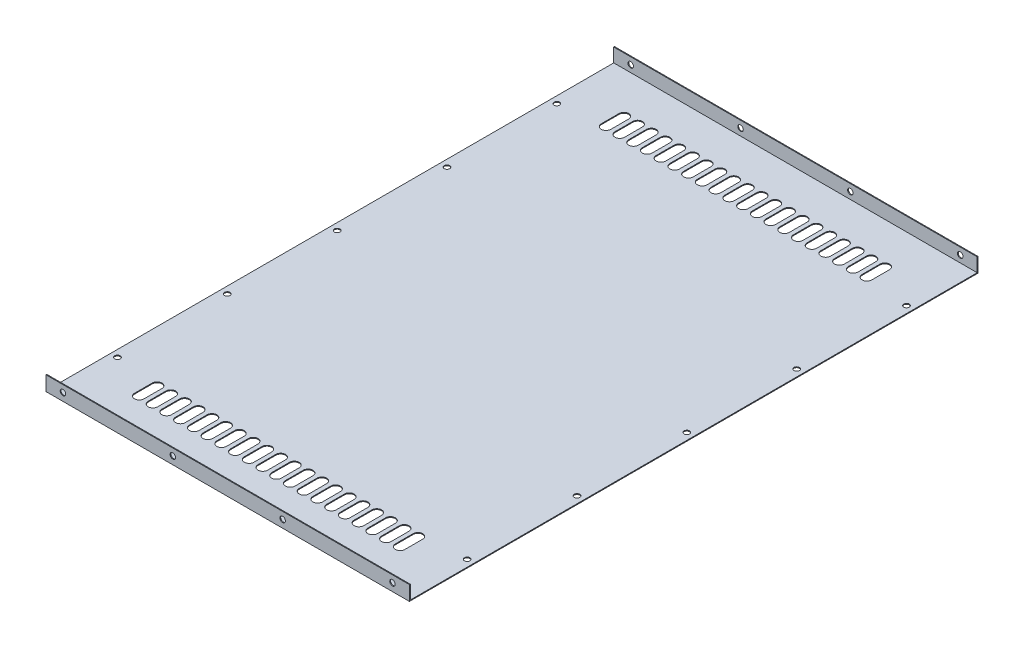
from build123d import *

# Parameters (mm, degrees)
SKETCH_1_W          = 264.7
SKETCH_1_H          = 414.1
EXTRUDE_1_DEPTH     = 0.6
SKETCH_2_W          = 0.6
SKETCH_2_H          = 10.6
EXTRUDE_2_DEPTH     = 264.7
SKETCH_6_R          = 2
CUT_EXTRUDE_1_DEPTH = 246.939474261
CUT_EXTRUDE_2_REACH = 436.865
SKETCH_7_R          = 2
CUT_EXTRUDE_4_DEPTH = 246.939474261


with BuildPart() as part:
    # Эскиз1 → Бобышка-Вытянуть1 (new body)
    with BuildSketch(Plane(origin=(0, 0, 0), x_dir=(1, 0, 0), z_dir=(0, 1, 0))):
        Rectangle(SKETCH_1_W, SKETCH_1_H)
    extrude(amount=EXTRUDE_1_DEPTH)

    # Эскиз2 → Бобышка-Вытянуть2 (add)
    with BuildSketch(Plane(origin=(132.35, 0, 0), x_dir=(0, 0, -1), z_dir=(1, 0, 0))):
        with Locations((-206.75, 5.3)):
            Rectangle(SKETCH_2_W, SKETCH_2_H)
        with Locations((206.75, 5.3)):
            Rectangle(SKETCH_2_W, SKETCH_2_H)
    extrude(amount=-EXTRUDE_2_DEPTH)

    # Эскиз6 → Вырез-Вытянуть1 (cut, through all)
    with BuildSketch(Plane(origin=(0, 0.6, 0), x_dir=(1, 0, 0), z_dir=(0, 1, 0))):
        with Locations(Location((-127.35, -160, 0), (0, 0, 270))):
            Circle(SKETCH_6_R)
        with Locations(Location((-127.35, -80, 0), (0, 0, 270))):
            Circle(SKETCH_6_R)
        with Locations(Location((-127.35, 0, 0), (0, 0, 270))):
            Circle(SKETCH_6_R)
        with Locations(Location((-127.35, 80, 0), (0, 0, 270))):
            Circle(SKETCH_6_R)
        with Locations(Location((-127.35, 160, 0), (0, 0, 270))):
            Circle(SKETCH_6_R)
        with Locations(Location((127.35, -160, 0), (0, 0, 270))):
            Circle(SKETCH_6_R)
        with Locations(Location((127.35, -80, 0), (0, 0, 270))):
            Circle(SKETCH_6_R)
        with Locations(Location((127.35, 0, 0), (0, 0, 270))):
            Circle(SKETCH_6_R)
        with Locations(Location((127.35, 80, 0), (0, 0, 270))):
            Circle(SKETCH_6_R)
        with Locations(Location((127.35, 160, 0), (0, 0, 270))):
            Circle(SKETCH_6_R)
    extrude(amount=-CUT_EXTRUDE_1_DEPTH, mode=Mode.SUBTRACT)

    # Вырез-Вытянуть2: up to this face of the body (flat: up to its plane)
    cut_extrude_2_end = Plane(part.part.faces().sort_by_distance((0, 5.3, 207.05))[0])
    # Эскиз7 → Вырез-Вытянуть2 (cut, up to the picked face)
    with BuildSketch(Plane(origin=(0, 0, -207.05), x_dir=(-1, 0, 0), z_dir=(0, 0, -1)), mode=Mode.PRIVATE) as cut_extrude_2_sk1:
        with Locations((-120, 5.6)):
            Circle(SKETCH_7_R)
    cut_extrude_2_tool1 = split(extrude(cut_extrude_2_sk1.sketch, amount=-CUT_EXTRUDE_2_REACH, mode=Mode.PRIVATE), bisect_by=cut_extrude_2_end, keep=Keep.BOTH, mode=Mode.PRIVATE)
    # Эскиз7 → Вырез-Вытянуть2 (cut, up to the picked face)
    with BuildSketch(Plane(origin=(0, 0, -207.05), x_dir=(-1, 0, 0), z_dir=(0, 0, -1)), mode=Mode.PRIVATE) as cut_extrude_2_sk2:
        with Locations((-40, 5.6)):
            Circle(SKETCH_7_R)
    cut_extrude_2_tool2 = split(extrude(cut_extrude_2_sk2.sketch, amount=-CUT_EXTRUDE_2_REACH, mode=Mode.PRIVATE), bisect_by=cut_extrude_2_end, keep=Keep.BOTH, mode=Mode.PRIVATE)
    # Эскиз7 → Вырез-Вытянуть2 (cut, up to the picked face)
    with BuildSketch(Plane(origin=(0, 0, -207.05), x_dir=(-1, 0, 0), z_dir=(0, 0, -1)), mode=Mode.PRIVATE) as cut_extrude_2_sk3:
        with Locations((40, 5.6)):
            Circle(SKETCH_7_R)
    cut_extrude_2_tool3 = split(extrude(cut_extrude_2_sk3.sketch, amount=-CUT_EXTRUDE_2_REACH, mode=Mode.PRIVATE), bisect_by=cut_extrude_2_end, keep=Keep.BOTH, mode=Mode.PRIVATE)
    # Эскиз7 → Вырез-Вытянуть2 (cut, up to the picked face)
    with BuildSketch(Plane(origin=(0, 0, -207.05), x_dir=(-1, 0, 0), z_dir=(0, 0, -1)), mode=Mode.PRIVATE) as cut_extrude_2_sk4:
        with Locations((120, 5.6)):
            Circle(SKETCH_7_R)
    cut_extrude_2_tool4 = split(extrude(cut_extrude_2_sk4.sketch, amount=-CUT_EXTRUDE_2_REACH, mode=Mode.PRIVATE), bisect_by=cut_extrude_2_end, keep=Keep.BOTH, mode=Mode.PRIVATE)
    add(cut_extrude_2_tool1.solids().sort_by(Axis((120, 5.6, -207.05), (0, 0, 1)))[0], mode=Mode.SUBTRACT)
    add(cut_extrude_2_tool2.solids().sort_by(Axis((40, 5.6, -207.05), (0, 0, 1)))[0], mode=Mode.SUBTRACT)
    add(cut_extrude_2_tool3.solids().sort_by(Axis((-40, 5.6, -207.05), (0, 0, 1)))[0], mode=Mode.SUBTRACT)
    add(cut_extrude_2_tool4.solids().sort_by(Axis((-120, 5.6, -207.05), (0, 0, 1)))[0], mode=Mode.SUBTRACT)

    # Эскиз8 → Вырез-Вытянуть4 (cut, through all)
    with BuildSketch(Plane(origin=(0, 0.6, 0), x_dir=(1, 0, 0), z_dir=(0, 1, 0))):
        with BuildLine():
            Line((-91.5, 176.5), (-91.5, 163.5))
            ThreePointArc((-91.5, 163.5), (-95, 160), (-98.5, 163.5))
            Line((-98.5, 163.5), (-98.5, 176.5))
            ThreePointArc((-98.5, 176.5), (-95, 180), (-91.5, 176.5))
        make_face()
        with BuildLine():
            Line((-81.5, 176.5), (-81.5, 163.5))
            ThreePointArc((-81.5, 163.5), (-85, 160), (-88.5, 163.5))
            Line((-88.5, 163.5), (-88.5, 176.5))
            ThreePointArc((-88.5, 176.5), (-85, 180), (-81.5, 176.5))
        make_face()
        with BuildLine():
            Line((-71.5, 176.5), (-71.5, 163.5))
            ThreePointArc((-71.5, 163.5), (-75, 160), (-78.5, 163.5))
            Line((-78.5, 163.5), (-78.5, 176.5))
            ThreePointArc((-78.5, 176.5), (-75, 180), (-71.5, 176.5))
        make_face()
        with BuildLine():
            Line((-61.5, 176.5), (-61.5, 163.5))
            ThreePointArc((-61.5, 163.5), (-65, 160), (-68.5, 163.5))
            Line((-68.5, 163.5), (-68.5, 176.5))
            ThreePointArc((-68.5, 176.5), (-65, 180), (-61.5, 176.5))
        make_face()
        with BuildLine():
            Line((-51.5, 176.5), (-51.5, 163.5))
            ThreePointArc((-51.5, 163.5), (-55, 160), (-58.5, 163.5))
            Line((-58.5, 163.5), (-58.5, 176.5))
            ThreePointArc((-58.5, 176.5), (-55, 180), (-51.5, 176.5))
        make_face()
        with BuildLine():
            Line((-41.5, 176.5), (-41.5, 163.5))
            ThreePointArc((-41.5, 163.5), (-45, 160), (-48.5, 163.5))
            Line((-48.5, 163.5), (-48.5, 176.5))
            ThreePointArc((-48.5, 176.5), (-45, 180), (-41.5, 176.5))
        make_face()
        with BuildLine():
            Line((-31.5, 176.5), (-31.5, 163.5))
            ThreePointArc((-31.5, 163.5), (-35, 160), (-38.5, 163.5))
            Line((-38.5, 163.5), (-38.5, 176.5))
            ThreePointArc((-38.5, 176.5), (-35, 180), (-31.5, 176.5))
        make_face()
        with BuildLine():
            Line((-21.5, 176.5), (-21.5, 163.5))
            ThreePointArc((-21.5, 163.5), (-25, 160), (-28.5, 163.5))
            Line((-28.5, 163.5), (-28.5, 176.5))
            ThreePointArc((-28.5, 176.5), (-25, 180), (-21.5, 176.5))
        make_face()
        with BuildLine():
            Line((-11.5, 176.5), (-11.5, 163.5))
            ThreePointArc((-11.5, 163.5), (-15, 160), (-18.5, 163.5))
            Line((-18.5, 163.5), (-18.5, 176.5))
            ThreePointArc((-18.5, 176.5), (-15, 180), (-11.5, 176.5))
        make_face()
        with BuildLine():
            Line((-1.5, 176.5), (-1.5, 163.5))
            ThreePointArc((-1.5, 163.5), (-5, 160), (-8.5, 163.5))
            Line((-8.5, 163.5), (-8.5, 176.5))
            ThreePointArc((-8.5, 176.5), (-5, 180), (-1.5, 176.5))
        make_face()
        with BuildLine():
            Line((8.5, 176.5), (8.5, 163.5))
            ThreePointArc((8.5, 163.5), (5, 160), (1.5, 163.5))
            Line((1.5, 163.5), (1.5, 176.5))
            ThreePointArc((1.5, 176.5), (5, 180), (8.5, 176.5))
        make_face()
        with BuildLine():
            Line((18.5, 176.5), (18.5, 163.5))
            ThreePointArc((18.5, 163.5), (15, 160), (11.5, 163.5))
            Line((11.5, 163.5), (11.5, 176.5))
            ThreePointArc((11.5, 176.5), (15, 180), (18.5, 176.5))
        make_face()
        with BuildLine():
            Line((28.5, 176.5), (28.5, 163.5))
            ThreePointArc((28.5, 163.5), (25, 160), (21.5, 163.5))
            Line((21.5, 163.5), (21.5, 176.5))
            ThreePointArc((21.5, 176.5), (25, 180), (28.5, 176.5))
        make_face()
        with BuildLine():
            Line((38.5, 176.5), (38.5, 163.5))
            ThreePointArc((38.5, 163.5), (35, 160), (31.5, 163.5))
            Line((31.5, 163.5), (31.5, 176.5))
            ThreePointArc((31.5, 176.5), (35, 180), (38.5, 176.5))
        make_face()
        with BuildLine():
            Line((48.5, 176.5), (48.5, 163.5))
            ThreePointArc((48.5, 163.5), (45, 160), (41.5, 163.5))
            Line((41.5, 163.5), (41.5, 176.5))
            ThreePointArc((41.5, 176.5), (45, 180), (48.5, 176.5))
        make_face()
        with BuildLine():
            Line((58.5, 176.5), (58.5, 163.5))
            ThreePointArc((58.5, 163.5), (55, 160), (51.5, 163.5))
            Line((51.5, 163.5), (51.5, 176.5))
            ThreePointArc((51.5, 176.5), (55, 180), (58.5, 176.5))
        make_face()
        with BuildLine():
            Line((68.5, 176.5), (68.5, 163.5))
            ThreePointArc((68.5, 163.5), (65, 160), (61.5, 163.5))
            Line((61.5, 163.5), (61.5, 176.5))
            ThreePointArc((61.5, 176.5), (65, 180), (68.5, 176.5))
        make_face()
        with BuildLine():
            Line((78.5, 176.5), (78.5, 163.5))
            ThreePointArc((78.5, 163.5), (75, 160), (71.5, 163.5))
            Line((71.5, 163.5), (71.5, 176.5))
            ThreePointArc((71.5, 176.5), (75, 180), (78.5, 176.5))
        make_face()
        with BuildLine():
            Line((88.5, 176.5), (88.5, 163.5))
            ThreePointArc((88.5, 163.5), (85, 160), (81.5, 163.5))
            Line((81.5, 163.5), (81.5, 176.5))
            ThreePointArc((81.5, 176.5), (85, 180), (88.5, 176.5))
        make_face()
        with BuildLine():
            Line((98.5, 176.5), (98.5, 163.5))
            ThreePointArc((98.5, 163.5), (95, 160), (91.5, 163.5))
            Line((91.5, 163.5), (91.5, 176.5))
            ThreePointArc((91.5, 176.5), (95, 180), (98.5, 176.5))
        make_face()
        with BuildLine():
            Line((-81.5, -163.5), (-81.5, -176.5))
            ThreePointArc((-81.5, -176.5), (-85, -180), (-88.5, -176.5))
            Line((-88.5, -176.5), (-88.5, -163.5))
            ThreePointArc((-88.5, -163.5), (-85, -160), (-81.5, -163.5))
        make_face()
        with BuildLine():
            Line((-71.5, -163.5), (-71.5, -176.5))
            ThreePointArc((-71.5, -176.5), (-75, -180), (-78.5, -176.5))
            Line((-78.5, -176.5), (-78.5, -163.5))
            ThreePointArc((-78.5, -163.5), (-75, -160), (-71.5, -163.5))
        make_face()
        with BuildLine():
            Line((-61.5, -163.5), (-61.5, -176.5))
            ThreePointArc((-61.5, -176.5), (-65, -180), (-68.5, -176.5))
            Line((-68.5, -176.5), (-68.5, -163.5))
            ThreePointArc((-68.5, -163.5), (-65, -160), (-61.5, -163.5))
        make_face()
        with BuildLine():
            Line((-51.5, -163.5), (-51.5, -176.5))
            ThreePointArc((-51.5, -176.5), (-55, -180), (-58.5, -176.5))
            Line((-58.5, -176.5), (-58.5, -163.5))
            ThreePointArc((-58.5, -163.5), (-55, -160), (-51.5, -163.5))
        make_face()
        with BuildLine():
            Line((-41.5, -163.5), (-41.5, -176.5))
            ThreePointArc((-41.5, -176.5), (-45, -180), (-48.5, -176.5))
            Line((-48.5, -176.5), (-48.5, -163.5))
            ThreePointArc((-48.5, -163.5), (-45, -160), (-41.5, -163.5))
        make_face()
        with BuildLine():
            Line((-31.5, -163.5), (-31.5, -176.5))
            ThreePointArc((-31.5, -176.5), (-35, -180), (-38.5, -176.5))
            Line((-38.5, -176.5), (-38.5, -163.5))
            ThreePointArc((-38.5, -163.5), (-35, -160), (-31.5, -163.5))
        make_face()
        with BuildLine():
            Line((-21.5, -163.5), (-21.5, -176.5))
            ThreePointArc((-21.5, -176.5), (-25, -180), (-28.5, -176.5))
            Line((-28.5, -176.5), (-28.5, -163.5))
            ThreePointArc((-28.5, -163.5), (-25, -160), (-21.5, -163.5))
        make_face()
        with BuildLine():
            Line((-11.5, -163.5), (-11.5, -176.5))
            ThreePointArc((-11.5, -176.5), (-15, -180), (-18.5, -176.5))
            Line((-18.5, -176.5), (-18.5, -163.5))
            ThreePointArc((-18.5, -163.5), (-15, -160), (-11.5, -163.5))
        make_face()
        with BuildLine():
            Line((-1.5, -163.5), (-1.5, -176.5))
            ThreePointArc((-1.5, -176.5), (-5, -180), (-8.5, -176.5))
            Line((-8.5, -176.5), (-8.5, -163.5))
            ThreePointArc((-8.5, -163.5), (-5, -160), (-1.5, -163.5))
        make_face()
        with BuildLine():
            Line((8.5, -163.5), (8.5, -176.5))
            ThreePointArc((8.5, -176.5), (5, -180), (1.5, -176.5))
            Line((1.5, -176.5), (1.5, -163.5))
            ThreePointArc((1.5, -163.5), (5, -160), (8.5, -163.5))
        make_face()
        with BuildLine():
            Line((18.5, -163.5), (18.5, -176.5))
            ThreePointArc((18.5, -176.5), (15, -180), (11.5, -176.5))
            Line((11.5, -176.5), (11.5, -163.5))
            ThreePointArc((11.5, -163.5), (15, -160), (18.5, -163.5))
        make_face()
        with BuildLine():
            Line((28.5, -163.5), (28.5, -176.5))
            ThreePointArc((28.5, -176.5), (25, -180), (21.5, -176.5))
            Line((21.5, -176.5), (21.5, -163.5))
            ThreePointArc((21.5, -163.5), (25, -160), (28.5, -163.5))
        make_face()
        with BuildLine():
            Line((38.5, -163.5), (38.5, -176.5))
            ThreePointArc((38.5, -176.5), (35, -180), (31.5, -176.5))
            Line((31.5, -176.5), (31.5, -163.5))
            ThreePointArc((31.5, -163.5), (35, -160), (38.5, -163.5))
        make_face()
        with BuildLine():
            Line((48.5, -163.5), (48.5, -176.5))
            ThreePointArc((48.5, -176.5), (45, -180), (41.5, -176.5))
            Line((41.5, -176.5), (41.5, -163.5))
            ThreePointArc((41.5, -163.5), (45, -160), (48.5, -163.5))
        make_face()
        with BuildLine():
            Line((58.5, -163.5), (58.5, -176.5))
            ThreePointArc((58.5, -176.5), (55, -180), (51.5, -176.5))
            Line((51.5, -176.5), (51.5, -163.5))
            ThreePointArc((51.5, -163.5), (55, -160), (58.5, -163.5))
        make_face()
        with BuildLine():
            Line((68.5, -163.5), (68.5, -176.5))
            ThreePointArc((68.5, -176.5), (65, -180), (61.5, -176.5))
            Line((61.5, -176.5), (61.5, -163.5))
            ThreePointArc((61.5, -163.5), (65, -160), (68.5, -163.5))
        make_face()
        with BuildLine():
            Line((78.5, -163.5), (78.5, -176.5))
            ThreePointArc((78.5, -176.5), (75, -180), (71.5, -176.5))
            Line((71.5, -176.5), (71.5, -163.5))
            ThreePointArc((71.5, -163.5), (75, -160), (78.5, -163.5))
        make_face()
        with BuildLine():
            Line((88.5, -163.5), (88.5, -176.5))
            ThreePointArc((88.5, -176.5), (85, -180), (81.5, -176.5))
            Line((81.5, -176.5), (81.5, -163.5))
            ThreePointArc((81.5, -163.5), (85, -160), (88.5, -163.5))
        make_face()
        with BuildLine():
            Line((98.5, -163.5), (98.5, -176.5))
            ThreePointArc((98.5, -176.5), (95, -180), (91.5, -176.5))
            Line((91.5, -176.5), (91.5, -163.5))
            ThreePointArc((91.5, -163.5), (95, -160), (98.5, -163.5))
        make_face()
        with BuildLine():
            Line((-91.5, -163.5), (-91.5, -176.5))
            ThreePointArc((-91.5, -176.5), (-95, -180), (-98.5, -176.5))
            Line((-98.5, -176.5), (-98.5, -163.5))
            ThreePointArc((-98.5, -163.5), (-95, -160), (-91.5, -163.5))
        make_face()
    extrude(amount=-CUT_EXTRUDE_4_DEPTH, mode=Mode.SUBTRACT)


solid = part.part
